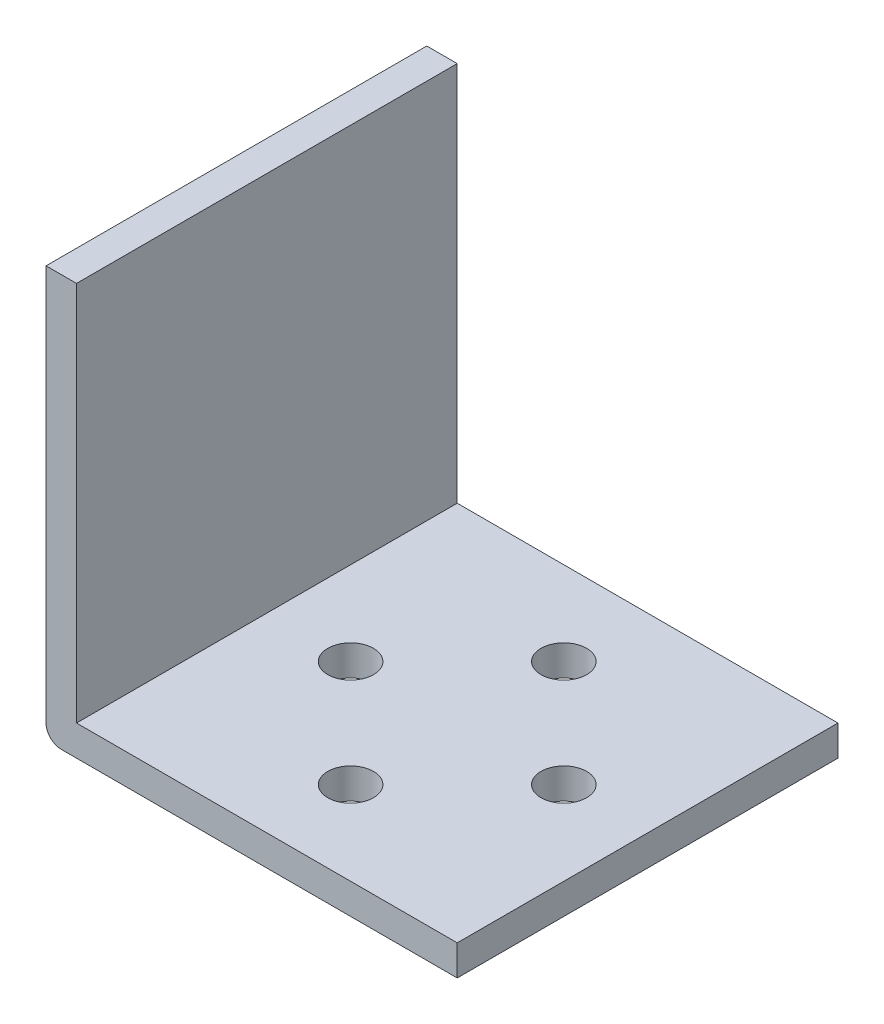
from build123d import *

# Parameters (mm, degrees)
SKETCH_1_W          = 27
SKETCH_1_H          = 25
EXTRUDE_1_DEPTH     = 2
SKETCH_2_W          = 2
SKETCH_2_H          = 25
EXTRUDE_2_DEPTH     = 25
SKETCH_3_R          = 1.5
CUT_EXTRUDE_1_DEPTH = 33.672618505
FILLET_1_R          = 1


with BuildPart() as part:
    # 草图1 → 凸台-拉伸1 (new body)
    with BuildSketch(Plane(origin=(0, 0, 0), x_dir=(1, 0, 0), z_dir=(0, 1, 0))):
        Rectangle(SKETCH_1_W, SKETCH_1_H)
    extrude(amount=EXTRUDE_1_DEPTH)

    # 草图2 → 凸台-拉伸2 (add)
    with BuildSketch(Plane(origin=(0, 2, 0), x_dir=(1, 0, 0), z_dir=(0, 1, 0))):
        with Locations((-12.5, 0)):
            Rectangle(SKETCH_2_W, SKETCH_2_H)
    extrude(amount=EXTRUDE_2_DEPTH)

    # 草图3 → 切除-拉伸1 (cut, through all)
    with BuildSketch(Plane.XZ):
        with Locations(Location((1, 7, 0), (0, 0, 270))):
            Circle(SKETCH_3_R)
        with Locations(Location((8, 0, 0), (0, 0, 270))):
            Circle(SKETCH_3_R)
        with Locations(Location((1, -7, 0), (0, 0, 270))):
            Circle(SKETCH_3_R)
        with Locations(Location((-6, 0, 0), (0, 0, 270))):
            Circle(SKETCH_3_R)
    extrude(amount=-CUT_EXTRUDE_1_DEPTH, mode=Mode.SUBTRACT)

    # 圆角1
    fillet_1_edges = [part.edges().sort_by_distance(p)[0] for p in [
        (-13.5, 0, 0),
    ]]
    fillet(fillet_1_edges, radius=FILLET_1_R)


solid = part.part
